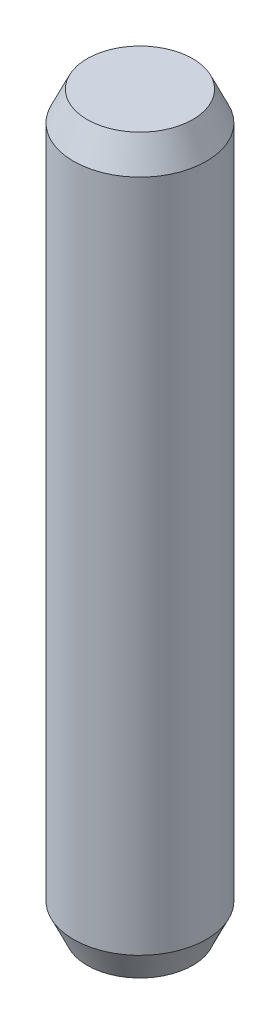
from build123d import *

# Parameters (mm, degrees)
SKETCH1_R           = 3.175
BOSS_EXTRUDE1_DEPTH = 35
CHAMFER1_SIZE       = 1.4
CHAMFER1_SIZE2      = 0.652830721


with BuildPart() as part:
    # Sketch1 → Boss-Extrude1 (new body)
    with BuildSketch(Plane(origin=(0, 0, 0), x_dir=(1, 0, 0), z_dir=(0, 1, 0))):
        with Locations(Location((0, 0, 0), (0, 0, 270))):
            Circle(SKETCH1_R)
    extrude(amount=BOSS_EXTRUDE1_DEPTH)

    # Chamfer1
    chamfer1_edges = [part.edges().sort_by_distance(p)[0] for p in [
        (0, 0, -3.175),
        (0, 35, -3.175),
    ]]
    chamfer1_side = [part.faces().sort_by_distance(p)[0] for p in [
        (0, 17.5, -3.175),
    ]]
    chamfer(chamfer1_edges, length=CHAMFER1_SIZE, length2=CHAMFER1_SIZE2, reference=chamfer1_side[0])


solid = part.part
